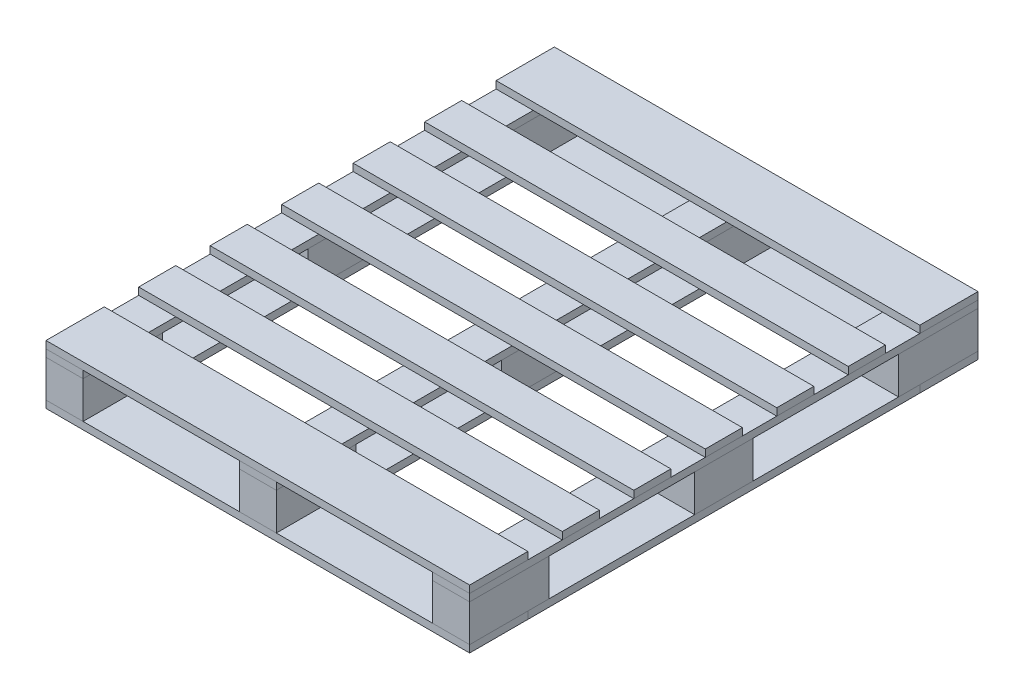
from build123d import *

# Parameters (mm, degrees)
BOSS_EXTRUDE1_DEPTH        = 609.6
BOSS_EXTRUDE1_DEPTH_BACK   = 609.6
SKETCH3_W                  = 88.9
SKETCH3_H                  = 17.4752
BOSS_EXTRUDE1_2_DEPTH      = 609.6
BOSS_EXTRUDE1_2_DEPTH_BACK = 609.6
BOSS_EXTRUDE1_3_DEPTH      = 609.6
BOSS_EXTRUDE1_3_DEPTH_BACK = 609.6
SKETCH4_W                  = 1016
SKETCH4_H                  = 139.7
BOSS_EXTRUDE2_DEPTH        = 17.4752
SKETCH4_H_2                = 88.9
BOSS_EXTRUDE2_2_DEPTH      = 17.4752
BOSS_EXTRUDE2_3_DEPTH      = 17.4752
BOSS_EXTRUDE2_4_DEPTH      = 17.4752
BOSS_EXTRUDE2_5_DEPTH      = 17.4752
BOSS_EXTRUDE2_6_DEPTH      = 17.4752
BOSS_EXTRUDE2_7_DEPTH      = 17.4752
SKETCH9_W                  = 88.9
SKETCH9_H                  = 190.5
BOSS_EXTRUDE4_DEPTH        = 88.7984
SKETCH9_H_2                = 139.7
BOSS_EXTRUDE4_2_DEPTH      = 88.7984
BOSS_EXTRUDE4_3_DEPTH      = 88.7984
BOSS_EXTRUDE4_4_DEPTH      = 88.7984
BOSS_EXTRUDE4_5_DEPTH      = 88.7984
BOSS_EXTRUDE4_6_DEPTH      = 88.7984
BOSS_EXTRUDE4_7_DEPTH      = 88.7984
BOSS_EXTRUDE4_8_DEPTH      = 88.7984
BOSS_EXTRUDE4_9_DEPTH      = 88.7984
SKETCH5_W                  = 1016
SKETCH5_H                  = 139.7
BOSS_EXTRUDE3_DEPTH        = 17.4752
BOSS_EXTRUDE3_2_DEPTH      = 17.4752
SKETCH11_W                 = 88.9
SKETCH11_H                 = 939.8
BOSS_EXTRUDE5_DEPTH        = 17.4752
BOSS_EXTRUDE5_2_DEPTH      = 17.4752
BOSS_EXTRUDE5_3_DEPTH      = 17.4752


with BuildPart() as part:
    # Sketch3 → Boss-Extrude1 (new, two sides: drawn at the far end of the back side and taken through both)
    with BuildSketch(Plane.XY.offset(-BOSS_EXTRUDE1_DEPTH_BACK)):
        with Locations((-463.55, 44.3992)):
            Rectangle(SKETCH3_W, SKETCH3_H)
    extrude(amount=BOSS_EXTRUDE1_DEPTH + BOSS_EXTRUDE1_DEPTH_BACK)


with BuildPart() as body_2:
    # Sketch3 → Boss-Extrude1 2 (new, two sides: drawn at the far end of the back side and taken through both)
    with BuildSketch(Plane.XY.offset(-BOSS_EXTRUDE1_2_DEPTH_BACK)):
        with Locations((0, 44.3992)):
            Rectangle(SKETCH3_W, SKETCH3_H)
    extrude(amount=BOSS_EXTRUDE1_2_DEPTH + BOSS_EXTRUDE1_2_DEPTH_BACK)


with BuildPart() as body_3:
    # Sketch3 → Boss-Extrude1 3 (new, two sides: drawn at the far end of the back side and taken through both)
    with BuildSketch(Plane.XY.offset(-BOSS_EXTRUDE1_3_DEPTH_BACK)):
        with Locations((463.55, 44.3992)):
            Rectangle(SKETCH3_W, SKETCH3_H)
    extrude(amount=BOSS_EXTRUDE1_3_DEPTH + BOSS_EXTRUDE1_3_DEPTH_BACK)


with BuildPart() as body_4:
    # Sketch4 → Boss-Extrude2 (new body)
    with BuildSketch(Plane(origin=(0, 53.1368, 0), x_dir=(-1, 0, 0), z_dir=(0, -1, 0))):
        with Locations((0, 539.75)):
            Rectangle(SKETCH4_W, SKETCH4_H)
    extrude(amount=-BOSS_EXTRUDE2_DEPTH)


with BuildPart() as body_5:
    # Sketch4 → Boss-Extrude2 2 (new body)
    with BuildSketch(Plane(origin=(0, 53.1368, 0), x_dir=(-1, 0, 0), z_dir=(0, -1, 0))):
        with Locations((0, 171.45)):
            Rectangle(SKETCH4_W, SKETCH4_H_2)
    extrude(amount=-BOSS_EXTRUDE2_2_DEPTH)


with BuildPart() as body_6:
    # Sketch4 → Boss-Extrude2 3 (new body)
    with BuildSketch(Plane(origin=(0, 53.1368, 0), x_dir=(-1, 0, 0), z_dir=(0, -1, 0))):
        with Locations((0, 342.9)):
            Rectangle(SKETCH4_W, SKETCH4_H_2)
    extrude(amount=-BOSS_EXTRUDE2_3_DEPTH)


with BuildPart() as body_7:
    # Sketch4 → Boss-Extrude2 4 (new body)
    with BuildSketch(Plane(origin=(0, 53.1368, 0), x_dir=(-1, 0, 0), z_dir=(0, -1, 0))):
        Rectangle(SKETCH4_W, SKETCH4_H_2)
    extrude(amount=-BOSS_EXTRUDE2_4_DEPTH)


with BuildPart() as body_8:
    # Sketch4 → Boss-Extrude2 5 (new body)
    with BuildSketch(Plane(origin=(0, 53.1368, 0), x_dir=(-1, 0, 0), z_dir=(0, -1, 0))):
        with Locations((0, -171.45)):
            Rectangle(SKETCH4_W, SKETCH4_H_2)
    extrude(amount=-BOSS_EXTRUDE2_5_DEPTH)


with BuildPart() as body_9:
    # Sketch4 → Boss-Extrude2 6 (new body)
    with BuildSketch(Plane(origin=(0, 53.1368, 0), x_dir=(-1, 0, 0), z_dir=(0, -1, 0))):
        with Locations((0, -342.9)):
            Rectangle(SKETCH4_W, SKETCH4_H_2)
    extrude(amount=-BOSS_EXTRUDE2_6_DEPTH)


with BuildPart() as body_10:
    # Sketch4 → Boss-Extrude2 7 (new body)
    with BuildSketch(Plane(origin=(0, 53.1368, 0), x_dir=(-1, 0, 0), z_dir=(0, -1, 0))):
        with Locations((0, -539.75)):
            Rectangle(SKETCH4_W, SKETCH4_H)
    extrude(amount=-BOSS_EXTRUDE2_7_DEPTH)


with BuildPart() as body_11:
    # Sketch9 → Boss-Extrude4 (new body)
    with BuildSketch(Plane.XZ.offset(-35.6616)):
        with Locations((463.55, 514.35)):
            Rectangle(SKETCH9_W, SKETCH9_H)
    extrude(amount=BOSS_EXTRUDE4_DEPTH)


with BuildPart() as body_12:
    # Sketch9 → Boss-Extrude4 2 (new body)
    with BuildSketch(Plane.XZ.offset(-35.6616)):
        with Locations((463.55, 0)):
            Rectangle(SKETCH9_W, SKETCH9_H_2)
    extrude(amount=BOSS_EXTRUDE4_2_DEPTH)


with BuildPart() as body_13:
    # Sketch9 → Boss-Extrude4 3 (new body)
    with BuildSketch(Plane.XZ.offset(-35.6616)):
        with Locations((463.55, -514.35)):
            Rectangle(SKETCH9_W, SKETCH9_H)
    extrude(amount=BOSS_EXTRUDE4_3_DEPTH)


with BuildPart() as body_14:
    # Sketch9 → Boss-Extrude4 4 (new body)
    with BuildSketch(Plane.XZ.offset(-35.6616)):
        with Locations((0, 514.35)):
            Rectangle(SKETCH9_W, SKETCH9_H)
    extrude(amount=BOSS_EXTRUDE4_4_DEPTH)


with BuildPart() as body_15:
    # Sketch9 → Boss-Extrude4 5 (new body)
    with BuildSketch(Plane.XZ.offset(-35.6616)):
        Rectangle(SKETCH9_W, SKETCH9_H_2)
    extrude(amount=BOSS_EXTRUDE4_5_DEPTH)


with BuildPart() as body_16:
    # Sketch9 → Boss-Extrude4 6 (new body)
    with BuildSketch(Plane.XZ.offset(-35.6616)):
        with Locations((0, -514.35)):
            Rectangle(SKETCH9_W, SKETCH9_H)
    extrude(amount=BOSS_EXTRUDE4_6_DEPTH)


with BuildPart() as body_17:
    # Sketch9 → Boss-Extrude4 7 (new body)
    with BuildSketch(Plane.XZ.offset(-35.6616)):
        with Locations((-463.55, 514.35)):
            Rectangle(SKETCH9_W, SKETCH9_H)
    extrude(amount=BOSS_EXTRUDE4_7_DEPTH)


with BuildPart() as body_18:
    # Sketch9 → Boss-Extrude4 8 (new body)
    with BuildSketch(Plane.XZ.offset(-35.6616)):
        with Locations((-463.55, 0)):
            Rectangle(SKETCH9_W, SKETCH9_H_2)
    extrude(amount=BOSS_EXTRUDE4_8_DEPTH)


with BuildPart() as body_19:
    # Sketch9 → Boss-Extrude4 9 (new body)
    with BuildSketch(Plane.XZ.offset(-35.6616)):
        with Locations((-463.55, -514.35)):
            Rectangle(SKETCH9_W, SKETCH9_H)
    extrude(amount=BOSS_EXTRUDE4_9_DEPTH)


with BuildPart() as body_20:
    # Sketch5 → Boss-Extrude3 (new body)
    with BuildSketch(Plane.XZ.offset(53.1368)):
        with Locations((0, 539.75)):
            Rectangle(SKETCH5_W, SKETCH5_H)
    extrude(amount=BOSS_EXTRUDE3_DEPTH)


with BuildPart() as body_21:
    # Sketch5 → Boss-Extrude3 2 (new body)
    with BuildSketch(Plane.XZ.offset(53.1368)):
        with Locations((0, -539.75)):
            Rectangle(SKETCH5_W, SKETCH5_H)
    extrude(amount=BOSS_EXTRUDE3_2_DEPTH)


with BuildPart() as body_22:
    # Sketch11 → Boss-Extrude5 (new body)
    with BuildSketch(Plane.XZ.offset(53.1368)):
        with Locations((-463.55, 0)):
            Rectangle(SKETCH11_W, SKETCH11_H)
    extrude(amount=BOSS_EXTRUDE5_DEPTH)


with BuildPart() as body_23:
    # Sketch11 → Boss-Extrude5 2 (new body)
    with BuildSketch(Plane.XZ.offset(53.1368)):
        Rectangle(SKETCH11_W, SKETCH11_H)
    extrude(amount=BOSS_EXTRUDE5_2_DEPTH)


with BuildPart() as body_24:
    # Sketch11 → Boss-Extrude5 3 (new body)
    with BuildSketch(Plane.XZ.offset(53.1368)):
        with Locations((463.55, 0)):
            Rectangle(SKETCH11_W, SKETCH11_H)
    extrude(amount=BOSS_EXTRUDE5_3_DEPTH)


solid = Compound([part.part, body_2.part, body_3.part, body_4.part, body_5.part, body_6.part, body_7.part, body_8.part, body_9.part, body_10.part, body_11.part, body_12.part, body_13.part, body_14.part, body_15.part, body_16.part, body_17.part, body_18.part, body_19.part, body_20.part, body_21.part, body_22.part, body_23.part, body_24.part])
